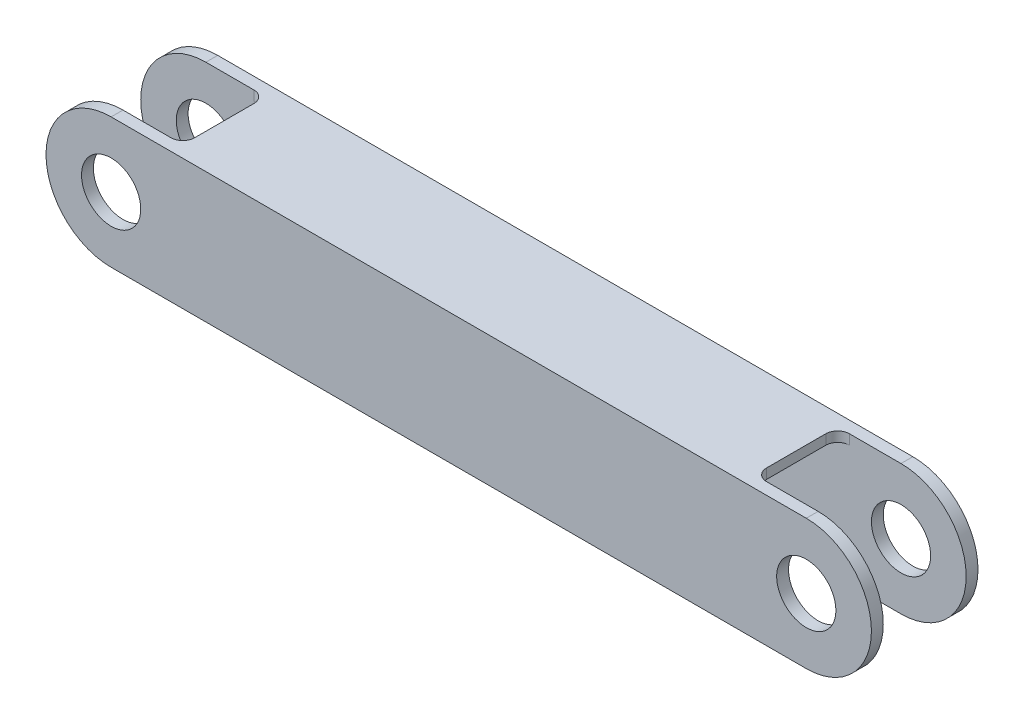
from build123d import *

# Parameters (mm, degrees)
SKETCH1_R           = 5
BOSS_EXTRUDE1_DEPTH = 2
SKETCH2_W           = 96.58456166
SKETCH2_H           = 1.682573812
BOSS_EXTRUDE2_DEPTH = 3.5
FILLET1_R           = 2


with BuildPart() as part:
    # Sketch1 → Boss-Extrude1 (new body)
    with BuildSketch(Plane.XY):
        with BuildLine():
            Line((-58.7, 0), (58.7, 0))
            ThreePointArc((58.7, 0), (69.7, 11), (58.7, 22))
            Line((58.7, 22), (-58.7, 22))
            ThreePointArc((-58.7, 22), (-69.7, 11), (-58.7, 0))
        make_face()
        with Locations((-58.7, 11)):
            Circle(SKETCH1_R, mode=Mode.SUBTRACT)
        with Locations((58.7, 11)):
            Circle(SKETCH1_R, mode=Mode.SUBTRACT)
    extrude(amount=BOSS_EXTRUDE1_DEPTH)

    # Sketch2 → Boss-Extrude2 (add)
    with BuildSketch(Plane.XY.offset(2)):
        with Locations((-0.304491052, 21.158713094)):
            Rectangle(SKETCH2_W, SKETCH2_H)
    boss_extrude2 = extrude(amount=BOSS_EXTRUDE2_DEPTH)

    # Mirror1: Boss-Extrude2 across plane
    add(boss_extrude2.mirror(Plane.XY.offset(5.5)))

    # Mirror2: part across plane


with BuildPart() as part_1:
    add(part.part)
    add(part.part.mirror(Plane(origin=(0, 0, 9), x_dir=(1, 0, 0), z_dir=(0, 0, -1))))

    # Fillet1
    fillet1_edges = [part_1.edges().sort_by_distance(p)[0] for p in [
        (-48.596771882, 21.158713094, 2),
        (47.987789778, 21.158713094, 2),
        (-48.596771882, 21.158713094, 16),
        (47.987789778, 21.158713094, 16),
    ]]
    fillet(fillet1_edges, radius=FILLET1_R)


solid = part_1.part
